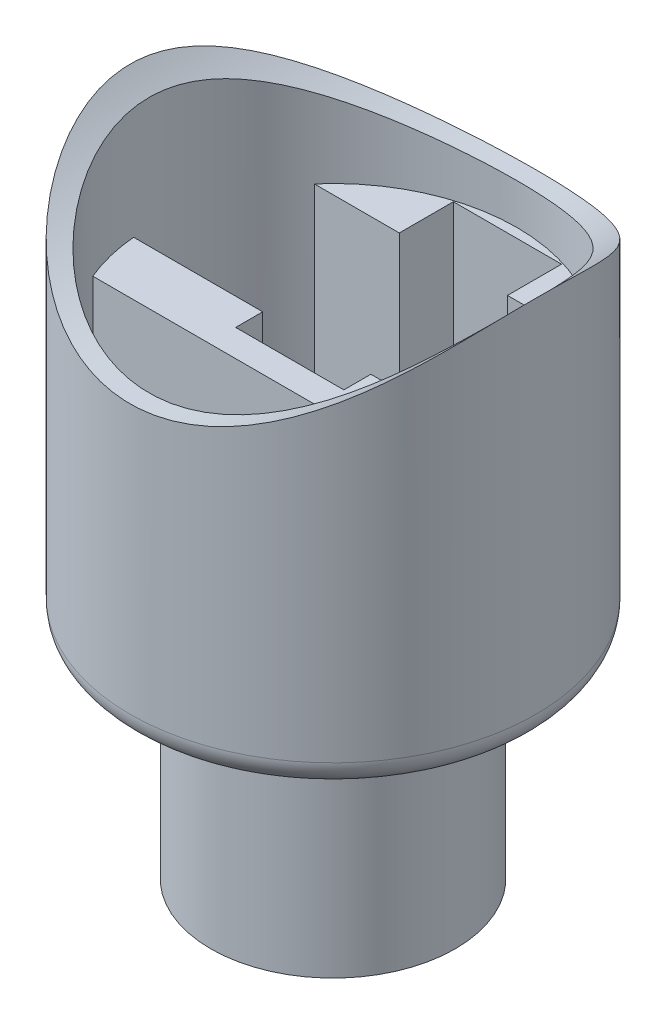
from build123d import *

# Parameters (mm, degrees)
SKETCH1_R               = 37.5
BOSS_EXTRUDE1_DEPTH     = 10
BOSS_EXTRUDE2_DEPTH     = 37.2
SKETCH2_3_R             = 37.5
BOSS_EXTRUDE3_DEPTH     = 94.7
CUT_EXTRUDE2_DEPTH      = 60
CUT_EXTRUDE2_DEPTH_BACK = 60
SKETCH3_R               = 50
SKETCH4_R               = 22.6
SKETCH4_R_2             = 19.6
BOSS_EXTRUDE4_DEPTH     = 40
FILLET1_R               = 5


with BuildPart() as part:
    # Sketch1 → Boss-Extrude1 (new body)
    with BuildSketch(Plane(origin=(0, 0, 0), x_dir=(1, 0, 0), z_dir=(0, 1, 0))):
        Circle(SKETCH1_R)
    extrude(amount=BOSS_EXTRUDE1_DEPTH)

    # Sketch2 → Boss-Extrude2 (add)
    with BuildSketch(Plane(origin=(0, 10, 0), x_dir=(1, 0, 0), z_dir=(0, 1, 0))):
        with BuildLine():
            ThreePointArc((25.708704752, 22.25), (0, 34), (-25.708704752, 22.25))
            Line((-25.708704752, 22.25), (-10, 22.25))
            Line((-10, 22.25), (-10, 32.25))
            Line((-10, 32.25), (10, 32.25))
            Line((10, 32.25), (10, 22.25))
            Line((10, 22.25), (25.708704752, 22.25))
        make_face()
        with BuildLine():
            Line((-10, -3), (-33.867388444, -3))
            ThreePointArc((-33.867388444, -3), (-33.022694549, -8.09330864), (-31.416556145, -13))
            Line((-31.416556145, -13), (31.416556145, -13))
            ThreePointArc((31.416556145, -13), (33.022694549, -8.09330864), (33.867388444, -3))
            Line((33.867388444, -3), (10, -3))
            Line((10, -3), (10, -8))
            Line((10, -8), (-10, -8))
            Line((-10, -8), (-10, -3))
        make_face()
    extrude(amount=BOSS_EXTRUDE2_DEPTH)

    # Sketch2<3> → Boss-Extrude3 (add)
    with BuildSketch(Plane(origin=(0, 10, 0), x_dir=(1, 0, 0), z_dir=(0, 1, 0))):
        Circle(SKETCH2_3_R)
        with BuildLine():
            ThreePointArc((-33.867388444, -3), (-32.353026831, 10.45378663), (-25.708704752, 22.25))
            ThreePointArc((-25.708704752, 22.25), (0, 34), (25.708704752, 22.25))
            ThreePointArc((25.708704752, 22.25), (31.859817651, 11.87232156), (34, 0))
            ThreePointArc((34, 0), (33.966830932, -1.50146477), (33.867388444, -3))
            ThreePointArc((33.867388444, -3), (33.022694549, -8.09330864), (31.416556145, -13))
            ThreePointArc((31.416556145, -13), (0, -34), (-31.416556145, -13))
            ThreePointArc((-31.416556145, -13), (-33.022694549, -8.09330864), (-33.867388444, -3))
        make_face(mode=Mode.SUBTRACT)
    extrude(amount=BOSS_EXTRUDE3_DEPTH)

    # Sketch3 → Cut-Extrude2 (cut, two sides: drawn at the far end of the back side and taken through both)
    with BuildSketch(Plane.XY.offset(-CUT_EXTRUDE2_DEPTH_BACK)):
        with Locations((0, 104.7)):
            Circle(SKETCH3_R)
    extrude(amount=CUT_EXTRUDE2_DEPTH + CUT_EXTRUDE2_DEPTH_BACK, mode=Mode.SUBTRACT)

    # Sketch4 → Boss-Extrude4 (add)
    with BuildSketch(Plane.XZ):
        Circle(SKETCH4_R)
        Circle(SKETCH4_R_2, mode=Mode.SUBTRACT)
    extrude(amount=BOSS_EXTRUDE4_DEPTH)

    # Fillet1
    fillet1_edges = [part.edges().sort_by_distance(p)[0] for p in [
        (-37.5, 0, 0),
    ]]
    fillet(fillet1_edges, radius=FILLET1_R)


solid = part.part
